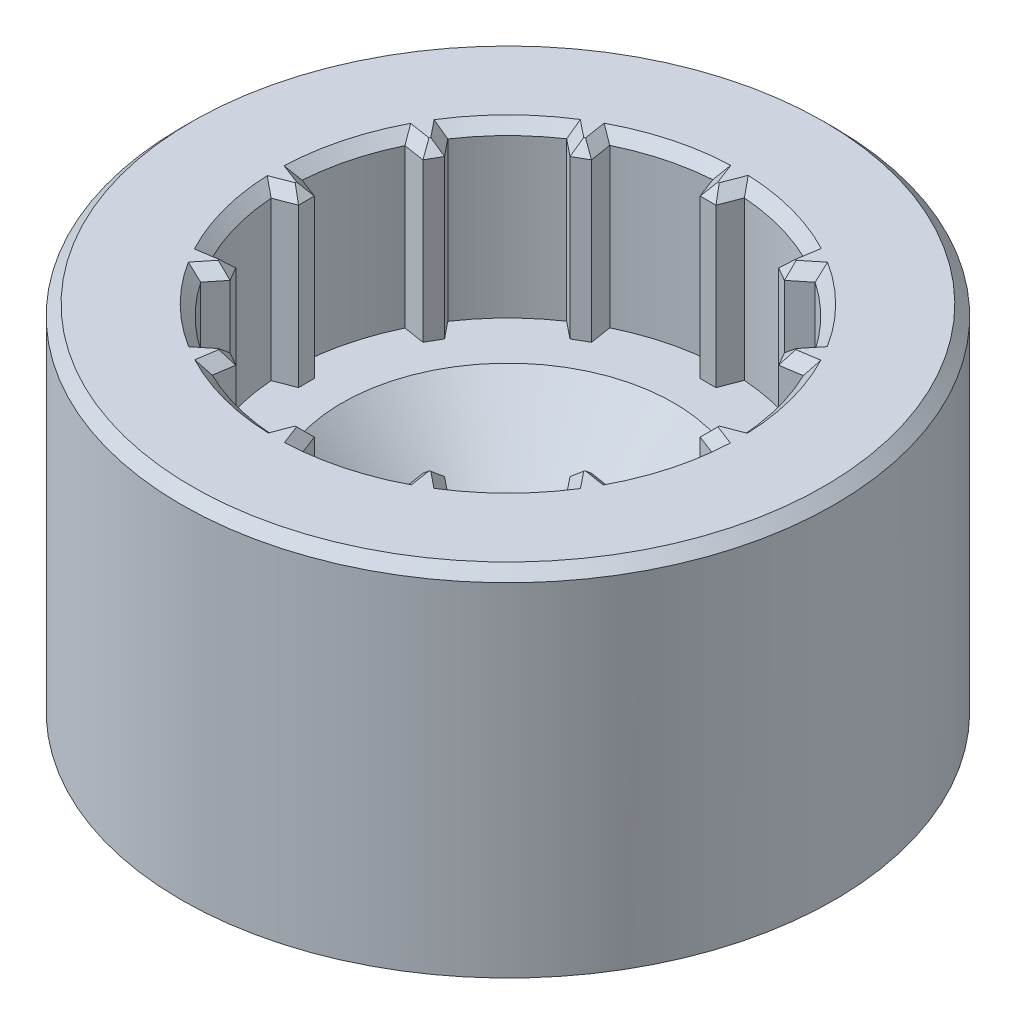
from build123d import *

# Parameters (mm, degrees)
EXTRUDE_1_REACH              = 13.035
PATTERN_CIRCULAR_1_COUNT     = 12
CHAMFER_1_SIZE               = 0.2
HOLE_WIZARD_M3_1_D           = 3.2
HOLE_WIZARD_M3_1_DEPTH       = 10
HOLE_WIZARD_M3_1_CSINK_D     = 6.3
HOLE_WIZARD_M3_1_CSINK_ANGLE = 90
HOLE_WIZARD_M3_1_TIP         = 0.96137699


with BuildPart() as part:
    # 草图1 → 旋转1 (revolve)
    with BuildSketch(Plane.XY, mode=Mode.PRIVATE) as revolve_1_sk:
        Polygon((0, 2), (4.2, 2), (4.2, 5.2), (6.2, 5.2), (6.2, -1.5), (2, -1.5), (2, 0), (0, 0), align=None)
    revolve(revolve_1_sk.sketch.rotate(Axis((0, 0, 0), (0, -1, 0)), 90), axis=Axis((0, 0, 0), (0, -1, 0)))

    # 草图6 → 凸台-拉伸1 (add, up to next)
    with BuildSketch(Plane(origin=(0, 5.2, 0), x_dir=(1, 0, 0), z_dir=(0, 1, 0)), mode=Mode.PRIVATE) as extrude_1_sk1:
        with BuildLine():
            Line((-0.3, 4.189272013), (-0.15, 3.8))
            Line((-0.15, 3.8), (0.15, 3.8))
            Line((0.15, 3.8), (0.3, 4.189272013))
            ThreePointArc((0.3, 4.189272013), (0, 4.2), (-0.3, 4.189272013))
        make_face()
    extrude_1_tool1 = extrude(extrude_1_sk1.sketch, amount=-EXTRUDE_1_REACH, mode=Mode.PRIVATE) - part.part
    extrude_1 = extrude_1_tool1.solids().sort_by_distance((0, 5.2, -4.020503))[0]
    add(extrude_1)

    # 阵列(圆周)1: 凸台-拉伸1 ×12 about axis
    pattern_circular_1_axis = Axis((0, 0, 0.0130623), (0, 1, 0))
    for i in range(1, PATTERN_CIRCULAR_1_COUNT):
        add(extrude_1.rotate(pattern_circular_1_axis, i * 360 / PATTERN_CIRCULAR_1_COUNT))

    # 倒角1
    chamfer_1_edges = [part.edges().sort_by_distance(p)[0] for p in [
        (-0.220099646, 5.2, 4.008043467),
        (0.220099646, 5.2, 4.008043467),
        (0, 5.2, 3.8261246),
        (2.963047356, 5.2, 2.976634066),
        (1.806983311, 5.2, 3.583533316),
        (2.188995086, 5.2, 3.363488592),
        (1.90653115, 5.2, 3.315271118),
        (4.053472149, 5.2, 1.099710659),
        (3.351583041, 5.2, 2.2034896),
        (3.573571791, 5.2, 1.820532654),
        (3.302208818, 5.2, 1.91959345),
        (4.060265001, 5.2, -1.0743594),
        (4.000883833, 5.2, 0.235436447),
        (4.001779561, 5.2, -0.209657003),
        (3.8130623, 5.2, 0.0130623),
        (2.976633055, 5.2, -2.963048372),
        (3.579482315, 5.2, -1.795336429),
        (3.356386981, 5.2, -2.183312937),
        (3.302208818, 5.2, -1.89346885),
        (1.090435686, 5.2, -4.055977073),
        (2.197803646, 5.2, -3.344478358),
        (1.808889205, 5.2, -3.569542645),
        (1.90653115, 5.2, -3.289146518),
        (-1.090435686, 5.2, -4.055977073),
        (-0.225, 5.2, -3.994636007),
        (0, 5.2, -3.8),
        (0.225, 5.2, -3.994636007),
        (-2.976633055, 5.2, -2.963048372),
        (-1.808889205, 5.2, -3.569542645),
        (-2.197803646, 5.2, -3.344478358),
        (-1.90653115, 5.2, -3.289146518),
        (-4.060265001, 5.2, -1.0743594),
        (-3.356386981, 5.2, -2.183312937),
        (-3.579482315, 5.2, -1.795336429),
        (-3.302208818, 5.2, -1.89346885),
        (-4.053472149, 5.2, 1.099710659),
        (-4.001779561, 5.2, -0.209657003),
        (-4.000883833, 5.2, 0.235436447),
        (-3.8130623, 5.2, 0.0130623),
        (-2.963047356, 5.2, 2.976634066),
        (-3.573571791, 5.2, 1.820532654),
        (-3.351583041, 5.2, 2.2034896),
        (-3.302208818, 5.2, 1.91959345),
        (0, 5.2, -6.2),
        (-1.083642839, 5.2, 4.05779721),
        (-2.188995086, 5.2, 3.363488592),
        (-1.806983311, 5.2, 3.583533316),
        (-1.90653115, 5.2, 3.315271118),
        (1.083642839, 5.2, 4.05779721),
    ]]
    chamfer(chamfer_1_edges, length=CHAMFER_1_SIZE)

    # M3 平头机械螺钉的锥形沉头孔1
    with Locations(Plane(origin=(0, 2, 0), x_dir=(1, 0, 0), z_dir=(0, 1, 0))):
        with Locations((0, 0)):
            CounterSinkHole(HOLE_WIZARD_M3_1_D / 2, HOLE_WIZARD_M3_1_CSINK_D / 2, depth=HOLE_WIZARD_M3_1_DEPTH, counter_sink_angle=HOLE_WIZARD_M3_1_CSINK_ANGLE)
            with Locations((0, 0, -(HOLE_WIZARD_M3_1_DEPTH + HOLE_WIZARD_M3_1_TIP / 2))):  # 118° drill point
                Cone(0, HOLE_WIZARD_M3_1_D / 2, HOLE_WIZARD_M3_1_TIP, mode=Mode.SUBTRACT)


solid = part.part
